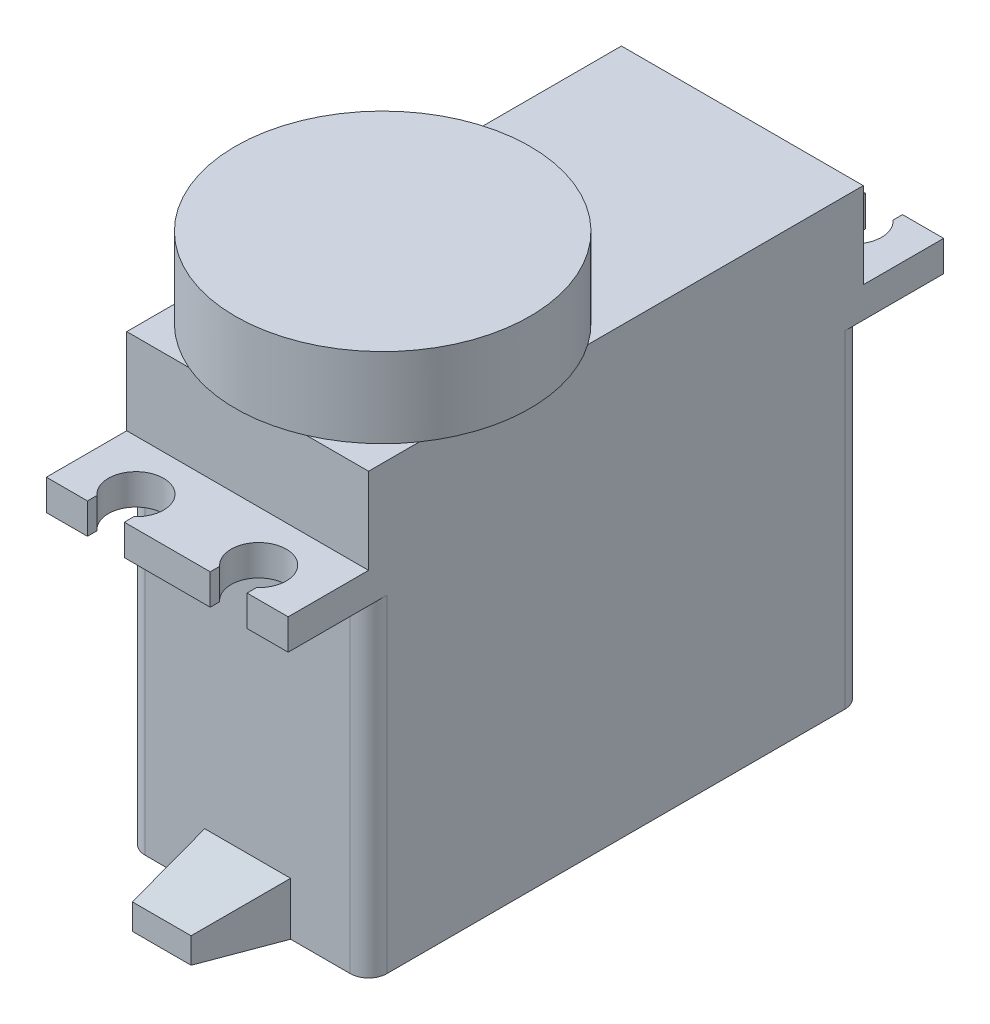
from build123d import *

# Parameters (mm, degrees)
ESQUISSE1_W                         = 40.3
ESQUISSE1_H                         = 36.195
BOSS_EXTRU_1_DEPTH                  = 9.85
ESQUISSE2_W                         = 53.4
ESQUISSE2_H                         = 2.5
BOSS_EXTRU_2_DEPTH                  = 19.7
ESQUISSE3_R                         = 12
BOSS_EXTRU_3_DEPTH                  = 6.5
ESQUISSE5_W                         = 7
ESQUISSE5_H                         = 4.3
BOSS_EXTRU_4_DEPTH                  = 7
BOSS_EXTRU_4_TAPER                  = 9
DIAM_TRE_DU_PER_AGE_4_5_4_5_1_D     = 4.5
DIAM_TRE_DU_PER_AGE_4_5_4_5_1_DEPTH = 3.2
DIAM_TRE_DU_PER_AGE_4_5_4_5_1_TIP   = 1.351936393
ESQUISSE9_W                         = 3
ESQUISSE9_H                         = 0.772949017
ENL_V_MAT_EXTRU_1_DEPTH             = 42.638473795
SYM_TRIE2_COPY_1_SKETCH_W           = 3
SYM_TRIE2_COPY_1_SKETCH_H           = 0.772949017
SYM_TRIE2_COPY_1_DEPTH              = 42.638473795
CONG_1_R                            = 1.5


with BuildPart() as part:
    # Esquisse1 → Boss.-Extru.1 (new, symmetric)
    with BuildSketch(Plane(origin=(0, 0, 0), x_dir=(0, 0, -1), z_dir=(1, 0, 0))):
        Rectangle(ESQUISSE1_W, ESQUISSE1_H)
    extrude(amount=BOSS_EXTRU_1_DEPTH, both=True)

    # Esquisse2 → Boss.-Extru.2 (add)
    with BuildSketch(Plane(origin=(-9.85, 0, 0), x_dir=(0, 0, -1), z_dir=(1, 0, 0))):
        with Locations((0, 9.8525)):
            Rectangle(ESQUISSE2_W, ESQUISSE2_H)
    extrude(amount=BOSS_EXTRU_2_DEPTH)

    # Esquisse3 → Boss.-Extru.3 (add)
    with BuildSketch(Plane(origin=(0, 18.0975, 0), x_dir=(1, 0, 0), z_dir=(0, 1, 0))):
        with Locations(Location((0, -9.15, 0), (0, 0, 34.831699177))):
            Circle(ESQUISSE3_R)
    extrude(amount=BOSS_EXTRU_3_DEPTH)

    # Esquisse5 → Boss.-Extru.4 (add)
    with BuildSketch(Plane.XY.offset(20.15)):
        with Locations((0, -15.9475)):
            Rectangle(ESQUISSE5_W, ESQUISSE5_H)
    extrude(amount=BOSS_EXTRU_4_DEPTH, taper=BOSS_EXTRU_4_TAPER)

    # Diamètre du perçage Ø4.5 (4.5)1
    with Locations(Plane(origin=(0, 11.1025, 0), x_dir=(1, 0, 0), z_dir=(0, 1, 0))):
        with Locations((5, 24.25), (-5, 24.25), (5, -24.25), (-5, -24.25)):
            Hole(DIAM_TRE_DU_PER_AGE_4_5_4_5_1_D / 2, depth=DIAM_TRE_DU_PER_AGE_4_5_4_5_1_DEPTH)
            with Locations((0, 0, -(DIAM_TRE_DU_PER_AGE_4_5_4_5_1_DEPTH + DIAM_TRE_DU_PER_AGE_4_5_4_5_1_TIP / 2))):  # 118° drill point
                Cone(0, DIAM_TRE_DU_PER_AGE_4_5_4_5_1_D / 2, DIAM_TRE_DU_PER_AGE_4_5_4_5_1_TIP, mode=Mode.SUBTRACT)

    # Esquisse9 → Enlèv. mat.-Extru.1 (cut, through all)
    with BuildSketch(Plane(origin=(0, 11.1025, 0), x_dir=(1, 0, 0), z_dir=(0, 1, 0))):
        with Locations((-5, 26.313525492)):
            Rectangle(ESQUISSE9_W, ESQUISSE9_H)
    enl_v_mat_extru_1 = extrude(amount=-ENL_V_MAT_EXTRU_1_DEPTH, mode=Mode.SUBTRACT)

    # Symétrie1: Enlèv. mat.-Extru.1 across plane
    add(enl_v_mat_extru_1.mirror(Plane(origin=(0, 0, 0), x_dir=(0, 0, 1), z_dir=(1, 0, 0))), mode=Mode.SUBTRACT)

    # Symétrie2: Enlèv. mat.-Extru.1 across plane
    add(enl_v_mat_extru_1.mirror(Plane.XY), mode=Mode.SUBTRACT)

    # Symétrie2 copy 1 sketch → Symétrie2 copy 1 (cut, through all)
    with BuildSketch(Plane(origin=(0, 11.1025, 0), x_dir=(-1, 0, 0), z_dir=(0, 1, 0))):
        with Locations((-5, 26.313525492)):
            Rectangle(SYM_TRIE2_COPY_1_SKETCH_W, SYM_TRIE2_COPY_1_SKETCH_H)
    extrude(amount=-SYM_TRIE2_COPY_1_DEPTH, mode=Mode.SUBTRACT)

    # Congé1
    cong_1_edges = [part.edges().sort_by_distance(p)[0] for p in [
        (-9.85, -4.7475, 20.15),
        (9.85, -4.7475, 20.15),
        (9.85, -4.7475, -20.15),
        (-9.85, -4.7475, -20.15),
    ]]
    fillet(cong_1_edges, radius=CONG_1_R)


solid = part.part
